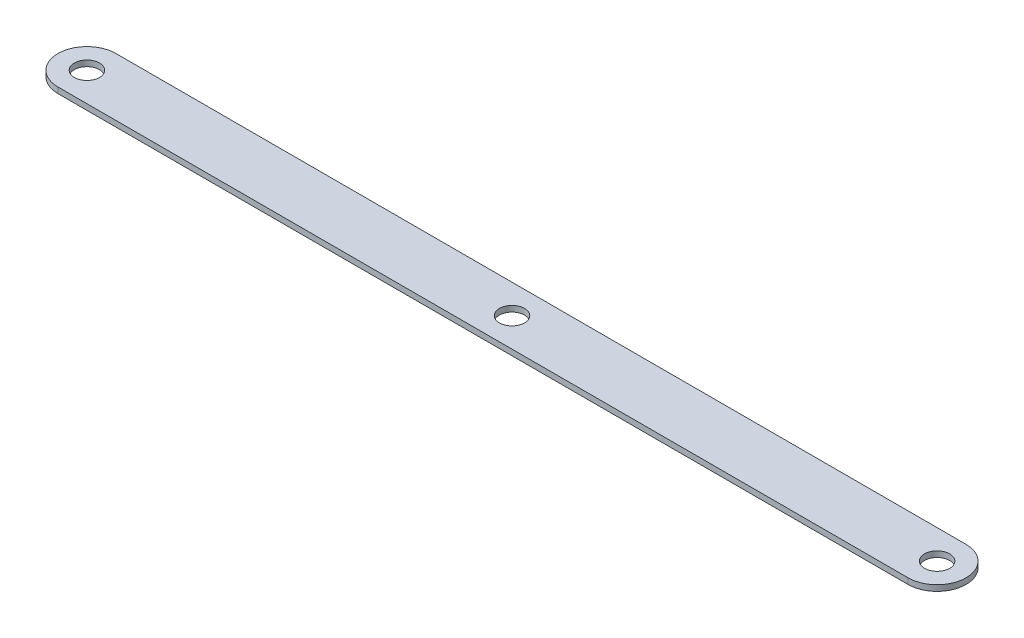
from build123d import *

# Parameters (mm, degrees)
EXTRUDE_1_DEPTH     = 1.5
SKETCH_2_R          = 3.25
CUT_EXTRUDE_1_DEPTH = 1.5


with BuildPart() as part:
    # 草图1 → 凸台-拉伸1 (new body)
    with BuildSketch(Plane(origin=(0, 0, 0), x_dir=(1, 0, 0), z_dir=(0, 1, 0))):
        with BuildLine():
            Line((110, -7.5), (-110, -7.5))
            ThreePointArc((-110, -7.5), (-117.5, 0), (-110, 7.5))
            Line((-110, 7.5), (110, 7.5))
            ThreePointArc((110, 7.5), (117.5, 0), (110, -7.5))
        make_face()
    extrude(amount=EXTRUDE_1_DEPTH)

    # 草图2 → 切除-拉伸1 (cut)
    with BuildSketch(Plane(origin=(0, 1.5, 0), x_dir=(1, 0, 0), z_dir=(0, 1, 0))):
        with Locations(Location((110, 0, 0), (0, 0, 270))):
            Circle(SKETCH_2_R)
        with Locations(Location((0, 0, 0), (0, 0, 270))):
            Circle(SKETCH_2_R)
        with Locations(Location((-110, 0, 0), (0, 0, 270))):
            Circle(SKETCH_2_R)
    extrude(amount=-CUT_EXTRUDE_1_DEPTH, mode=Mode.SUBTRACT)


solid = part.part
